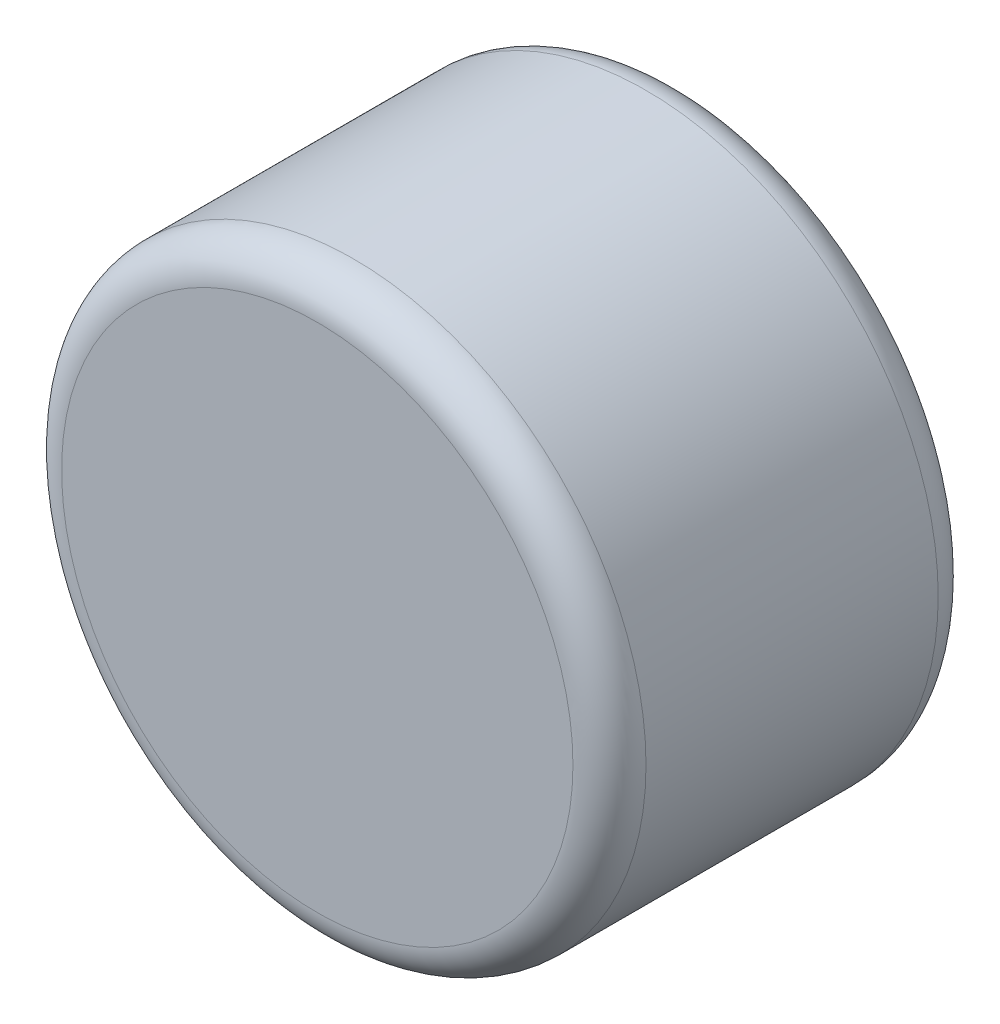
from build123d import *

# Parameters (mm, degrees)
ESQUISSE1_R        = 4
BOSS_EXTRU_1_DEPTH = 5
CONG_1_R           = 0.5


with BuildPart() as part:
    # Esquisse1 → Boss.-Extru.1 (new body)
    with BuildSketch(Plane.XY):
        Circle(ESQUISSE1_R)
    extrude(amount=BOSS_EXTRU_1_DEPTH)

    # Congé1
    cong_1_edges = [part.edges().sort_by_distance(p)[0] for p in [
        (-4, 0, 0),
        (-4, 0, 5),
    ]]
    fillet(cong_1_edges, radius=CONG_1_R)


solid = part.part
